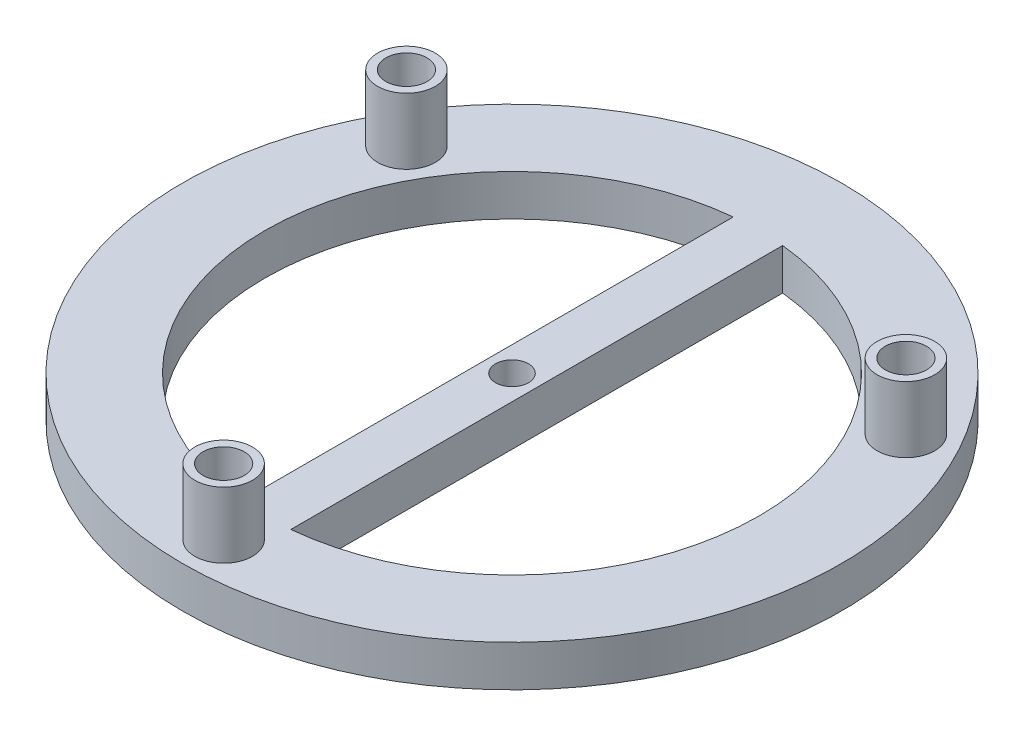
from build123d import *

# Parameters (mm, degrees)
SKETCH_3_R               = 40
EXTRUDE_2_DEPTH          = 5
CUT_EXTRUDE_2_DEPTH      = 10
SKETCH_6_R               = 2
CUT_EXTRUDE_3_DEPTH      = 10
SKETCH_8_R               = 3.5
SKETCH_8_R_2             = 2.5
EXTRUDE_3_DEPTH          = 8
PATTERN_CIRCULAR_1_COUNT = 3


with BuildPart() as part:
    # 草图3 → 凸台-拉伸2 (new body)
    with BuildSketch(Plane(origin=(0, 0, 0), x_dir=(1, 0, 0), z_dir=(0, 1, 0))):
        with Locations(Location((0, 0, 0), (0, 0, 270))):
            Circle(SKETCH_3_R)
    extrude(amount=EXTRUDE_2_DEPTH)

    # 草图5 → 切除-拉伸2 (cut)
    with BuildSketch(Plane(origin=(0, 5, 0), x_dir=(1, 0, 0), z_dir=(0, 1, 0))):
        with BuildLine():
            Line((-3, -29.849623113), (-3, 29.849623113))
            ThreePointArc((-3, 29.849623113), (-30, 0), (-3, -29.849623113))
        make_face()
        with BuildLine():
            ThreePointArc((30, 0), (22.248595461, 20.124611797), (3, 29.849623113))
            Line((3, 29.849623113), (3, -29.849623113))
            ThreePointArc((3, -29.849623113), (22.248595461, -20.124611797), (30, 0))
        make_face()
    extrude(amount=-CUT_EXTRUDE_2_DEPTH, mode=Mode.SUBTRACT)

    # 草图6 → 切除-拉伸3 (cut)
    with BuildSketch(Plane(origin=(0, 5, 0), x_dir=(1, 0, 0), z_dir=(0, 1, 0))):
        with Locations(Location((0, 0, 0), (0, 0, 270))):
            Circle(SKETCH_6_R)
    extrude(amount=-CUT_EXTRUDE_3_DEPTH, mode=Mode.SUBTRACT)

    # 草图8 → 凸台-拉伸3 (add)
    with BuildSketch(Plane(origin=(0, 5, 0), x_dir=(1, 0, 0), z_dir=(0, 1, 0))):
        with Locations(Location((0, -35, 0), (0, 0, 270))):
            Circle(SKETCH_8_R)
        with Locations(Location((0, -35, 0), (0, 0, 270))):
            Circle(SKETCH_8_R_2, mode=Mode.SUBTRACT)
    extrude_3 = extrude(amount=EXTRUDE_3_DEPTH)

    # 阵列(圆周)1: 凸台-拉伸3 ×3 about axis
    pattern_circular_1_axis = Axis((0, 0, 0), (0, 1, 0))
    for i in range(1, PATTERN_CIRCULAR_1_COUNT):
        add(extrude_3.rotate(pattern_circular_1_axis, i * 360 / PATTERN_CIRCULAR_1_COUNT))


solid = part.part
